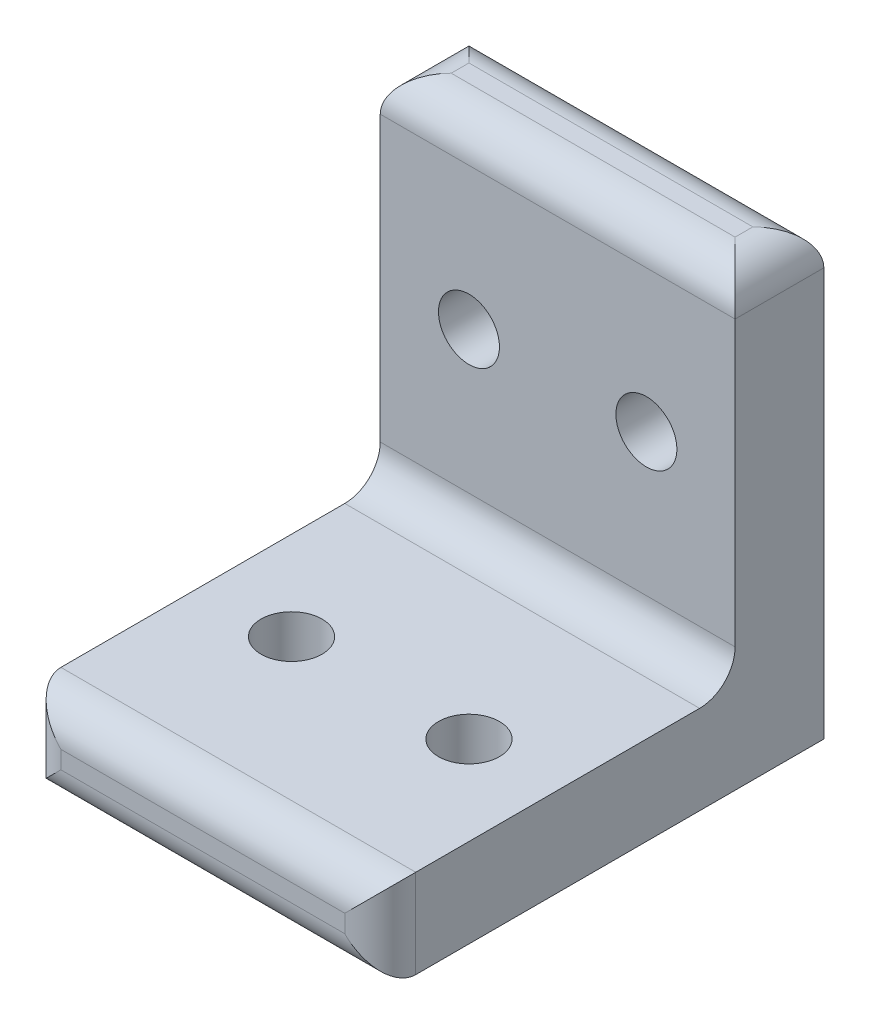
from build123d import *

# Parameters (mm, degrees)
SKETCH1_W                        = 25.4
SKETCH1_H                        = 25.4
BOSS_EXTRUDE1_DEPTH              = 6.35
SKETCH2_W                        = 25.4
SKETCH2_H                        = 31.75
BOSS_EXTRUDE2_DEPTH              = 6.35
FILLET1_R                        = 2.54
F_11_64_0_17188_DIAMETER_HOLE1_D = 4.365752
F_11_64_0_17188_DIAMETER_HOLE2_D = 4.365752


with BuildPart() as part:
    # Sketch1 → Boss-Extrude1 (new body)
    with BuildSketch(Plane(origin=(0, 0, 0), x_dir=(1, 0, 0), z_dir=(0, 1, 0))):
        Rectangle(SKETCH1_W, SKETCH1_H)
    extrude(amount=BOSS_EXTRUDE1_DEPTH)

    # Sketch2 → Boss-Extrude2 (add)
    with BuildSketch(Plane(origin=(0, 0, -12.7), x_dir=(-1, 0, 0), z_dir=(0, 0, -1))):
        with Locations((0, 15.875)):
            Rectangle(SKETCH2_W, SKETCH2_H)
    extrude(amount=BOSS_EXTRUDE2_DEPTH)

    # Fillet1
    fillet1_edges = [part.edges().sort_by_distance(p)[0] for p in [
        (0, 31.75, -12.7),
        (-12.7, 31.75, -15.875),
        (12.7, 31.75, -15.875),
        (0, 6.35, 12.7),
        (0, 31.75, -19.05),
        (0, 0, 12.7),
        (12.7, 3.175, 12.7),
        (-12.7, 3.175, 12.7),
        (0, 6.35, -12.7),
    ]]
    fillet(fillet1_edges, radius=FILLET1_R)

    # 11/64 (0.17188) Diameter Hole1 (through all)
    with Locations(Plane(origin=(0, 6.35, 0), x_dir=(1, 0, 0), z_dir=(0, 1, 0))):
        with Locations((-6.35, 0), (6.35, 0)):
            Hole(F_11_64_0_17188_DIAMETER_HOLE1_D / 2)

    # 11/64 (0.17188) Diameter Hole2 (through all)
    with Locations(Plane.XY.offset(-12.7)):
        with Locations((6.35, 19.05), (-6.35, 19.05)):
            Hole(F_11_64_0_17188_DIAMETER_HOLE2_D / 2)


solid = part.part
